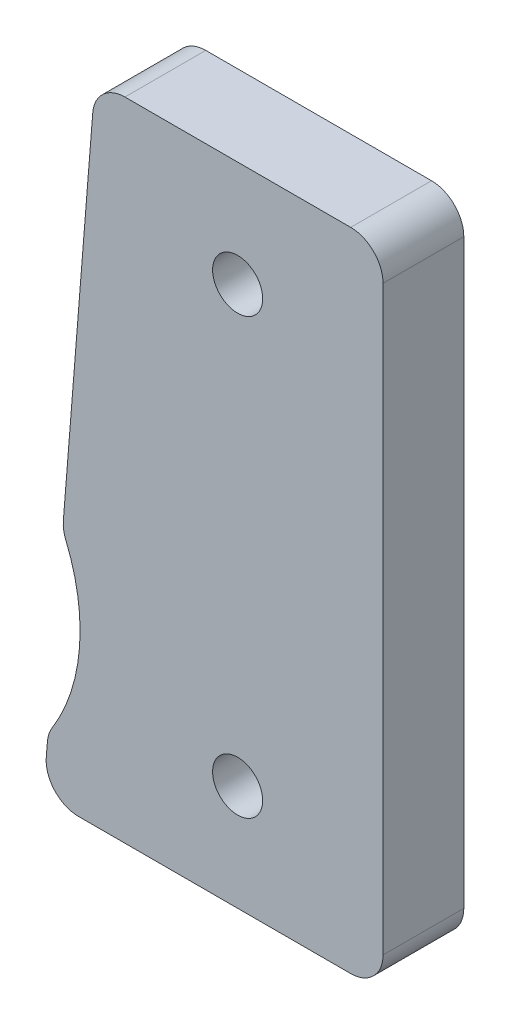
from build123d import *

# Parameters (mm, degrees)
SKETCH_1_W               = 30
SKETCH_1_H               = 40
EXTRUDE_1_DEPTH          = 5
CUT_EXTRUDE_1_DEPTH      = 800
SKETCH_3_R               = 1.55
CUT_EXTRUDE_2_DEPTH      = 10
FILLET_1_R               = 2
SKETCH_4_R               = 11.5
CUT_EXTRUDE_3_DEPTH      = 10
FILLET_2_R               = 2
CUT_EXTRUDE_5_DEPTH      = 26.495097568
CUT_EXTRUDE_5_DEPTH_BACK = 5
FILLET_4_R               = 2


with BuildPart() as part:
    # 草图1 → 凸台-拉伸1 (new body)
    with BuildSketch(Plane.XY):
        Rectangle(SKETCH_1_W, SKETCH_1_H)
    extrude(amount=EXTRUDE_1_DEPTH)

    # 草图2 → 切除-拉伸1 (cut)
    with BuildSketch(Plane.XY.offset(5)):
        Polygon((-8.819854033, 20), (-12.017512264, -20), (-15, -20), (-15, 20), align=None)
    extrude(amount=-CUT_EXTRUDE_1_DEPTH, mode=Mode.SUBTRACT)

    # 草图3 → 切除-拉伸2 (cut)
    with BuildSketch(Plane.XY.offset(5)):
        with Locations((0, 13.45)):
            Circle(SKETCH_3_R)
        with Locations((0, -13.45)):
            Circle(SKETCH_3_R)
    extrude(amount=-CUT_EXTRUDE_2_DEPTH, mode=Mode.SUBTRACT)

    # 圆角1
    fillet_1_edges = [part.edges().sort_by_distance(p)[0] for p in [
        (-12.017512264, -20, 2.5),
        (-8.819854033, 20, 2.5),
        (15, -20, 2.5),
        (15, 20, 2.5),
    ]]
    fillet(fillet_1_edges, radius=FILLET_1_R)

    # 草图4 → 切除-拉伸3 (cut)
    with BuildSketch(Plane.XY.offset(5)):
        with Locations((-21.25, -10)):
            Circle(SKETCH_4_R)
    extrude(amount=-CUT_EXTRUDE_3_DEPTH, mode=Mode.SUBTRACT)

    # 圆角2
    fillet_2_edges = [part.edges().sort_by_distance(p)[0] for p in [
        (-11.734337347, -16.457721291, 2.5),
        (-10.829264337, -5.136023413, 2.5),
    ]]
    fillet(fillet_2_edges, radius=FILLET_2_R)

    # 草图6 → 切除-拉伸5 (cut, two sides: drawn at the far end of the back side and taken through both)
    with BuildSketch(Plane.XY.offset(5).offset(-CUT_EXTRUDE_5_DEPTH_BACK)):
        Polygon((9, 120.21695141), (9, 20), (9, -20), (9, -120.21695141), (209.433902819, -120.21695141), (209.433902819, 120.21695141), align=None)
    extrude(amount=CUT_EXTRUDE_5_DEPTH + CUT_EXTRUDE_5_DEPTH_BACK, mode=Mode.SUBTRACT)

    # 圆角4
    fillet_4_edges = [part.edges().sort_by_distance(p)[0] for p in [
        (9, 20, 2.5),
        (9, -20, 2.5),
    ]]
    fillet(fillet_4_edges, radius=FILLET_4_R)


solid = part.part
